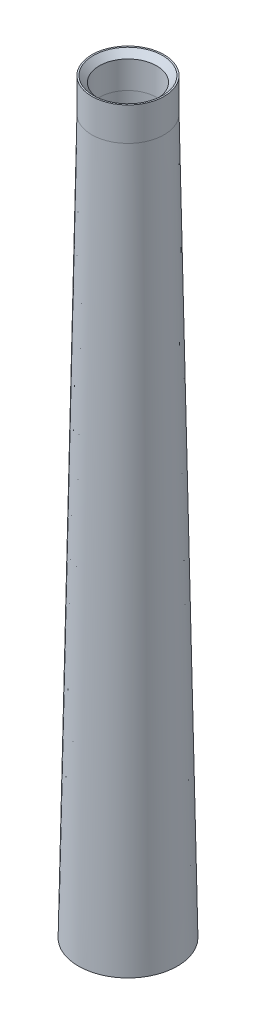
from build123d import *

# Parameters (mm, degrees)
SKETCH3_R           = 7.7216
SKETCH3_R_2         = 6.13382221
BOSS_EXTRUDE1_DEPTH = 7.112
CHAMFER1_SIZE       = 1.27


with BuildPart() as part:
    # Sketch1 → Revolve1 (revolve)
    with BuildSketch(Plane(origin=(0, 0, 0), x_dir=(0, 0, -1), z_dir=(1, 0, 0))):
        Polygon((0, 152.4), (0, 0), (-10.57275, 0), (-7.7216, 152.4), align=None)
    revolve(axis=Axis((0, 152.4, 0), (0, -1, 0)))

    # Sketch2 → Cut-Revolve4 (revolve, cut)
    with BuildSketch(Plane(origin=(0, 0, 0), x_dir=(0, 0, -1), z_dir=(1, 0, 0))):
        Polygon((0, 152.4), (0, 0), (-8.98497221, 0), (-6.13382221, 152.4), align=None)
    revolve(axis=Axis((0, 287.681750321, 0), (0, -1, 0)), mode=Mode.SUBTRACT)

    # Sketch3 → Boss-Extrude1 (add)
    with BuildSketch(Plane(origin=(0, 152.4, 0), x_dir=(1, 0, 0), z_dir=(0, 1, 0))):
        with Locations(Location((0, 0, 0), (0, 0, 270))):
            Circle(SKETCH3_R)
        with Locations(Location((0, 0, 0), (0, 0, 270))):
            Circle(SKETCH3_R_2, mode=Mode.SUBTRACT)
    extrude(amount=BOSS_EXTRUDE1_DEPTH)

    # Chamfer1
    chamfer1_edges = [part.edges().sort_by_distance(p)[0] for p in [
        (0, 159.512, -6.13382221),
    ]]
    chamfer(chamfer1_edges, length=CHAMFER1_SIZE)


solid = part.part
